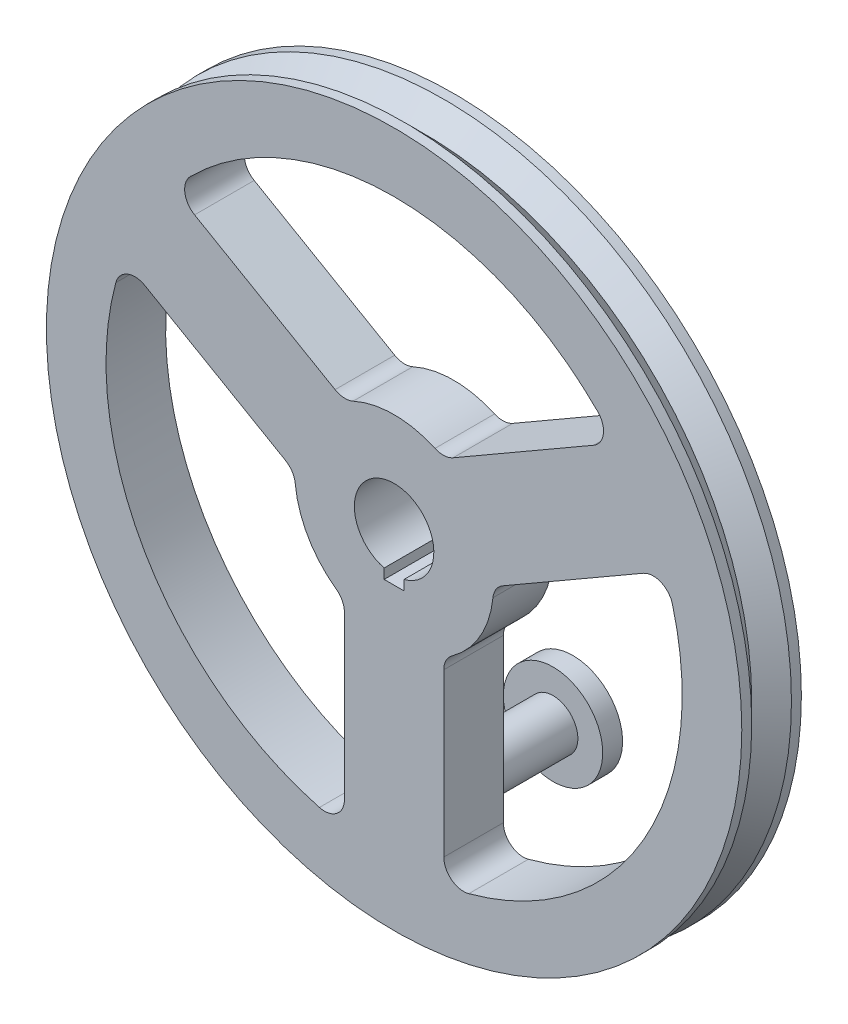
from build123d import *

# Parameters (mm, degrees)
SKETCH1_R           = 175
BOSS_EXTRUDE4_DEPTH = 15
SKETCH2_R           = 12.5
BOSS_EXTRUDE5_DEPTH = 50
SKETCH3_R           = 25
BOSS_EXTRUDE6_DEPTH = 10


with BuildPart() as part:
    # Sketch1 → Boss-Extrude4 (new, symmetric)
    with BuildSketch(Plane.XY):
        Circle(SKETCH1_R)
        with BuildLine():
            Line((25, -48.733971724), (25, -130.384048104))
            ThreePointArc((25, -130.384048104), (28.914193805, -138.31896858), (37.592592593, -140.042125741))
            ThreePointArc((37.592592593, -140.042125741), (125.573683549, -72.5), (140.076334788, 37.464922691))
            ThreePointArc((140.076334788, 37.464922691), (134.244837518, 44.119057925), (125.415897906, 43.541388957))
            Line((125.415897906, 43.541388957), (54.70485754, 2.716350767))
            ThreePointArc((54.70485754, 2.716350767), (51.30322786, -0.52056309), (49.75404795, -4.953252725))
            ThreePointArc((49.75404795, -4.953252725), (43.301270189, -25), (29.166666667, -40.611643103))
            ThreePointArc((29.166666667, -40.611643103), (26.10243479, -44.169617078), (25, -48.733971724))
        make_face(mode=Mode.SUBTRACT)
        with BuildLine():
            Line((-25, -48.733971724), (-25, -130.384048104))
            ThreePointArc((-25, -130.384048104), (-28.914193805, -138.31896858), (-37.592592593, -140.042125741))
            ThreePointArc((-37.592592593, -140.042125741), (-125.573683549, -72.5), (-140.076334788, 37.464922691))
            ThreePointArc((-140.076334788, 37.464922691), (-134.244837518, 44.119057925), (-125.415897906, 43.541388957))
            Line((-125.415897906, 43.541388957), (-54.70485754, 2.716350767))
            ThreePointArc((-54.70485754, 2.716350767), (-51.30322786, -0.52056309), (-49.75404795, -4.953252725))
            ThreePointArc((-49.75404795, -4.953252725), (-43.301270189, -25), (-29.166666667, -40.611643103))
            ThreePointArc((-29.166666667, -40.611643103), (-26.10243479, -44.169617078), (-25, -48.733971724))
        make_face(mode=Mode.SUBTRACT)
        with BuildLine():
            Line((-29.70485754, 46.017620957), (-100.415897906, 86.842659147))
            ThreePointArc((-100.415897906, 86.842659147), (-105.330643713, 94.199910656), (-102.483742196, 102.57720305))
            ThreePointArc((-102.483742196, 102.57720305), (0, 145), (102.483742196, 102.57720305))
            ThreePointArc((102.483742196, 102.57720305), (105.330643713, 94.199910656), (100.415897906, 86.842659147))
            Line((100.415897906, 86.842659147), (29.70485754, 46.017620957))
            ThreePointArc((29.70485754, 46.017620957), (25.20079307, 44.690180168), (20.587381284, 45.564895829))
            ThreePointArc((20.587381284, 45.564895829), (0, 50), (-20.587381284, 45.564895829))
            ThreePointArc((-20.587381284, 45.564895829), (-25.20079307, 44.690180168), (-29.70485754, 46.017620957))
        make_face(mode=Mode.SUBTRACT)
        with BuildLine():
            Line((-5, -19.364916731), (-5, -24.364916731))
            Line((-5, -24.364916731), (5, -24.364916731))
            Line((5, -24.364916731), (5, -19.364916731))
            ThreePointArc((5, -19.364916731), (0, 20), (-5, -19.364916731))
        make_face(mode=Mode.SUBTRACT)
    extrude(amount=BOSS_EXTRUDE4_DEPTH, both=True)

    # Sketch2 → Boss-Extrude5 (add)
    with BuildSketch(Plane(origin=(0, 0, -15), x_dir=(-1, 0, 0), z_dir=(0, 0, -1))):
        with Locations(Location((0, -125, 0), (0, 0, 180))):
            Circle(SKETCH2_R)
    extrude(amount=BOSS_EXTRUDE5_DEPTH)

    # Sketch3 → Boss-Extrude6 (add)
    with BuildSketch(Plane(origin=(0, 0, -65), x_dir=(-1, 0, 0), z_dir=(0, 0, -1))):
        with Locations((0, -125)):
            Circle(SKETCH3_R)
    extrude(amount=BOSS_EXTRUDE6_DEPTH)

    # Sketch4 → Cut-Revolve1 (revolve, cut)
    with BuildSketch(Plane(origin=(0, 0, 0), x_dir=(1, 0, 0), z_dir=(0, 1, 0)), mode=Mode.PRIVATE) as cut_revolve1_sk:
        Polygon((-175, -10), (-165, 0), (-175, 10), align=None)
    revolve(cut_revolve1_sk.sketch.rotate(Axis((0, 0, 35.70915695), (0, 0, -1)), 180), axis=Axis((0, 0, 35.70915695), (0, 0, -1)), mode=Mode.SUBTRACT)


solid = part.part
